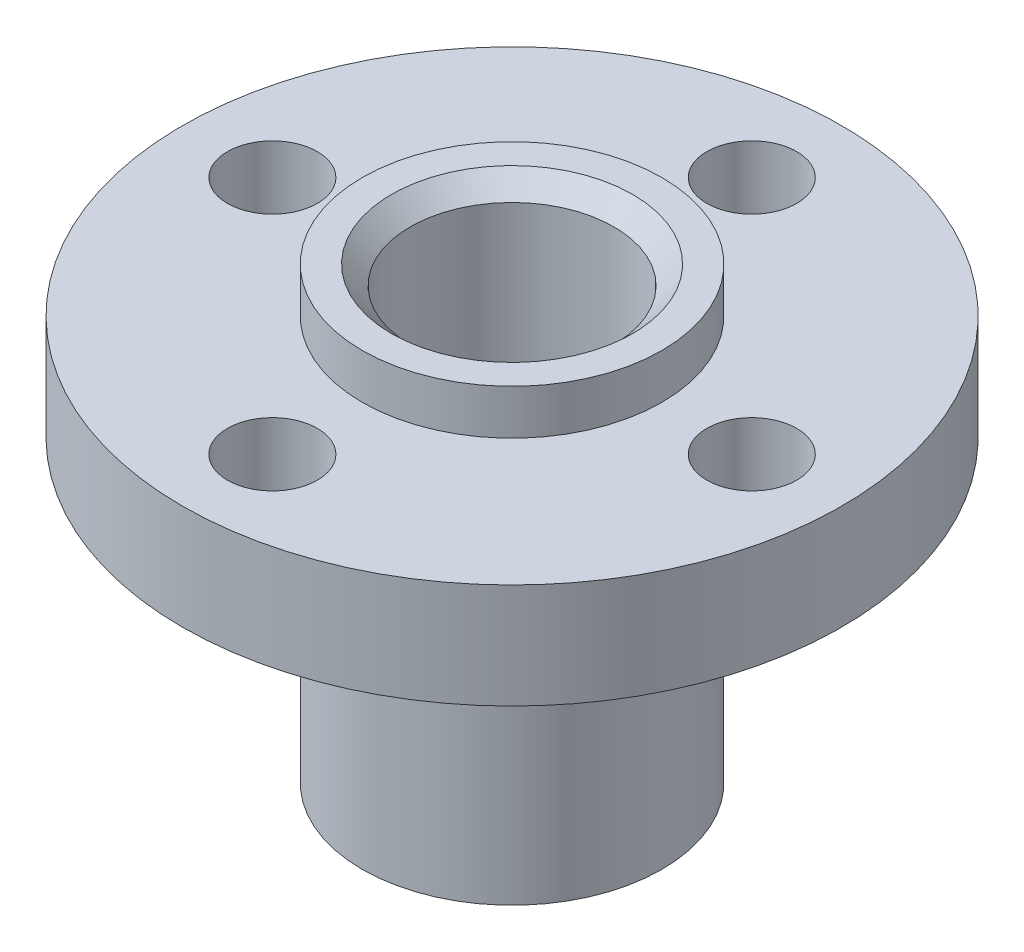
from build123d import *

# Parameters (mm, degrees)
EXTRUDE_2_DEPTH              = 5
EXTRUDE_2_DEPTH_BACK         = 10
SKETCH_1_R                   = 5
SKETCH_2_R                   = 11
SKETCH_2_R_2                 = 1.5
EXTRUDE_3_DEPTH              = 3.5
HOLE_WIZARD_M8_1_D           = 6.8
HOLE_WIZARD_M8_1_DEPTH       = 22.25
HOLE_WIZARD_M8_1_CSINK_D     = 8.05
HOLE_WIZARD_M8_1_CSINK_ANGLE = 90
HOLE_WIZARD_M8_1_TIP         = 2.042926105


with BuildPart() as part:
    # 草图1 → 凸台-拉伸2 (new, two sides: drawn at the far end of the back side and taken through both)
    with BuildSketch(Plane(origin=(0, 0, 0), x_dir=(1, 0, 0), z_dir=(0, 1, 0)).offset(-EXTRUDE_2_DEPTH_BACK)):
        with Locations(Location((0, 0, 0), (0, 0, 270))):
            Circle(SKETCH_1_R)
    extrude(amount=EXTRUDE_2_DEPTH + EXTRUDE_2_DEPTH_BACK)

    # 草图2 → 凸台-拉伸3 (add)
    with BuildSketch(Plane(origin=(0, 0, 0), x_dir=(1, 0, 0), z_dir=(0, 1, 0))):
        with Locations(Location((0, 0, 0), (0, 0, 270))):
            Circle(SKETCH_2_R)
        with Locations(Location((8, 0, 0), (0, 0, 270))):
            Circle(SKETCH_2_R_2, mode=Mode.SUBTRACT)
        with Locations(Location((0, 8, 0), (0, 0, 270))):
            Circle(SKETCH_2_R_2, mode=Mode.SUBTRACT)
        with Locations(Location((-8, 0, 0), (0, 0, 270))):
            Circle(SKETCH_2_R_2, mode=Mode.SUBTRACT)
        with Locations(Location((0, -8, 0), (0, 0, 270))):
            Circle(SKETCH_2_R_2, mode=Mode.SUBTRACT)
    extrude(amount=EXTRUDE_3_DEPTH)

    # M8 螺纹孔1
    with Locations(Plane(origin=(0, 5, 0), x_dir=(1, 0, 0), z_dir=(0, 1, 0))):
        with Locations((0, 0)):
            CounterSinkHole(HOLE_WIZARD_M8_1_D / 2, HOLE_WIZARD_M8_1_CSINK_D / 2, depth=HOLE_WIZARD_M8_1_DEPTH, counter_sink_angle=HOLE_WIZARD_M8_1_CSINK_ANGLE)
            with Locations((0, 0, -(HOLE_WIZARD_M8_1_DEPTH + HOLE_WIZARD_M8_1_TIP / 2))):  # 118° drill point
                Cone(0, HOLE_WIZARD_M8_1_D / 2, HOLE_WIZARD_M8_1_TIP, mode=Mode.SUBTRACT)


solid = part.part
